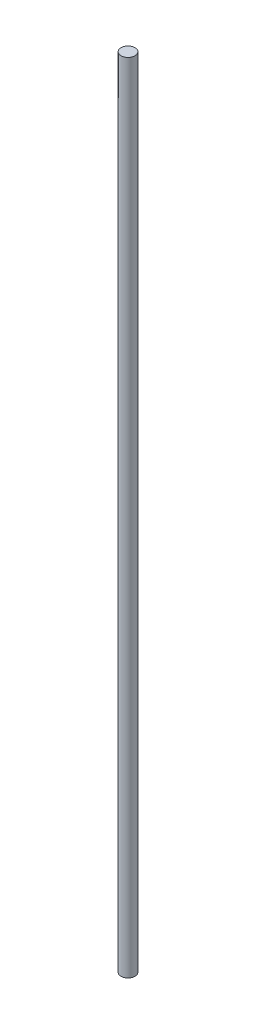
from build123d import *

# Parameters (mm, degrees)
SKETCH1_R           = 4
BOSS_EXTRUDE1_DEPTH = 455.9


with BuildPart() as part:
    # Sketch1 → Boss-Extrude1 (new body)
    with BuildSketch(Plane(origin=(0, 0, 0), x_dir=(1, 0, 0), z_dir=(0, 1, 0))):
        with Locations(Location((0, 0, 0), (0, 0, 90))):
            Circle(SKETCH1_R)
    extrude(amount=BOSS_EXTRUDE1_DEPTH)


solid = part.part
